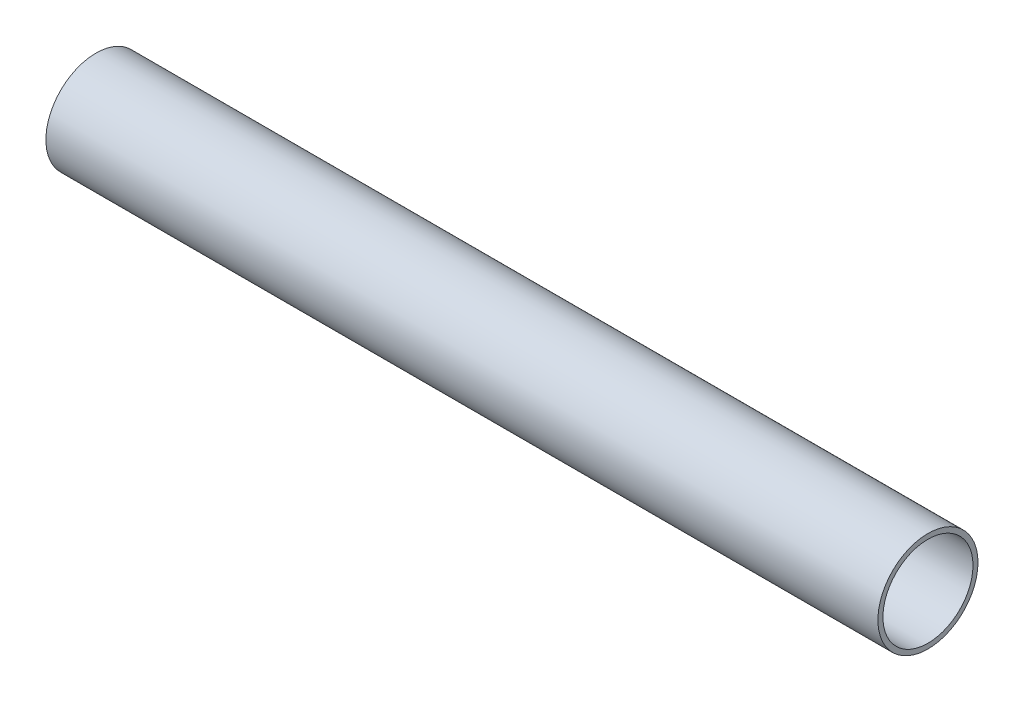
from build123d import *

# Parameters (mm, degrees)
SKETCH1_R           = 15.875
SKETCH1_R_2         = 14.2875
EXTRUDE_THIN1_DEPTH = 131.9557559


with BuildPart() as part:
    # Sketch1 → Extrude-Thin1 (new, symmetric)
    with BuildSketch(Plane(origin=(0, 0, 0), x_dir=(0, 0, -1), z_dir=(1, 0, 0))):
        Circle(SKETCH1_R)
        Circle(SKETCH1_R_2, mode=Mode.SUBTRACT)
    extrude(amount=EXTRUDE_THIN1_DEPTH, both=True)


solid = part.part
